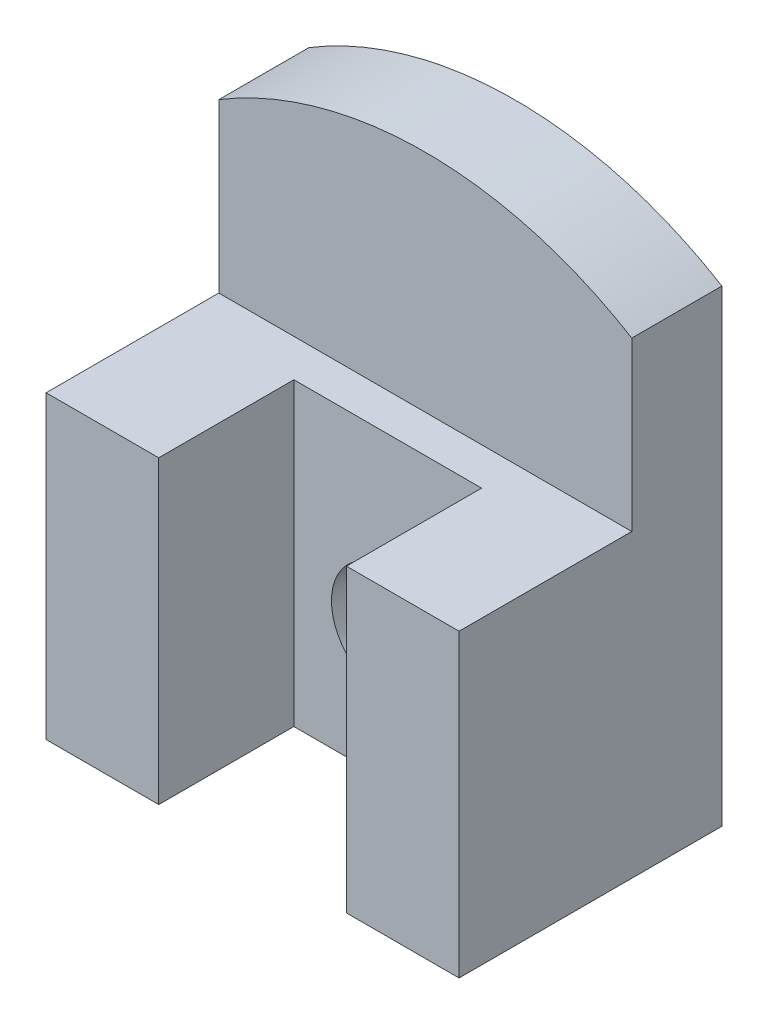
from build123d import *

# Parameters (mm, degrees)
BOSS_EXTRU_2_DEPTH      = 40
ESQUISSE2_W             = 55
ESQUISSE2_H             = 12
BOSS_EXTRU_3_DEPTH      = 40
BOSS_EXTRU_4_DEPTH      = 12
ESQUISSE4_R             = 7.5
ENL_V_MAT_EXTRU_1_DEPTH = 96.655632349


with BuildPart() as part:
    # Esquisse1 → Boss.-Extru.2 (new body)
    with BuildSketch(Plane(origin=(0, 0, 0), x_dir=(1, 0, 0), z_dir=(0, 1, 0))):
        Polygon((0, 0), (0, 23), (55, 23), (55, 0), (40, 0), (40, 18), (15, 18), (15, 0), align=None)
    extrude(amount=BOSS_EXTRU_2_DEPTH)

    # Esquisse2 → Boss.-Extru.3 (add)
    with BuildSketch(Plane(origin=(0, 0, 0), x_dir=(1, 0, 0), z_dir=(0, 1, 0))):
        with Locations((27.5, 29)):
            Rectangle(ESQUISSE2_W, ESQUISSE2_H)
    extrude(amount=BOSS_EXTRU_3_DEPTH)

    # Esquisse3 → Boss.-Extru.4 (add)
    with BuildSketch(Plane(origin=(0, 0, -35), x_dir=(-1, 0, 0), z_dir=(0, 0, -1))):
        with BuildLine():
            Line((-55, 40), (-55, 62.307284183))
            ThreePointArc((-55, 62.307284183), (-27.5, 70), (0, 62.307284183))
            Line((0, 62.307284183), (0, 40))
            Line((0, 40), (-55, 40))
        make_face()
    extrude(amount=-BOSS_EXTRU_4_DEPTH)

    # Esquisse4 → Enlèv. mat.-Extru.1 (cut, through all)
    with BuildSketch(Plane(origin=(0, 0, -35), x_dir=(-1, 0, 0), z_dir=(0, 0, -1))):
        with Locations((-27.5, 17)):
            Circle(ESQUISSE4_R)
    extrude(amount=-ENL_V_MAT_EXTRU_1_DEPTH, mode=Mode.SUBTRACT)


solid = part.part
